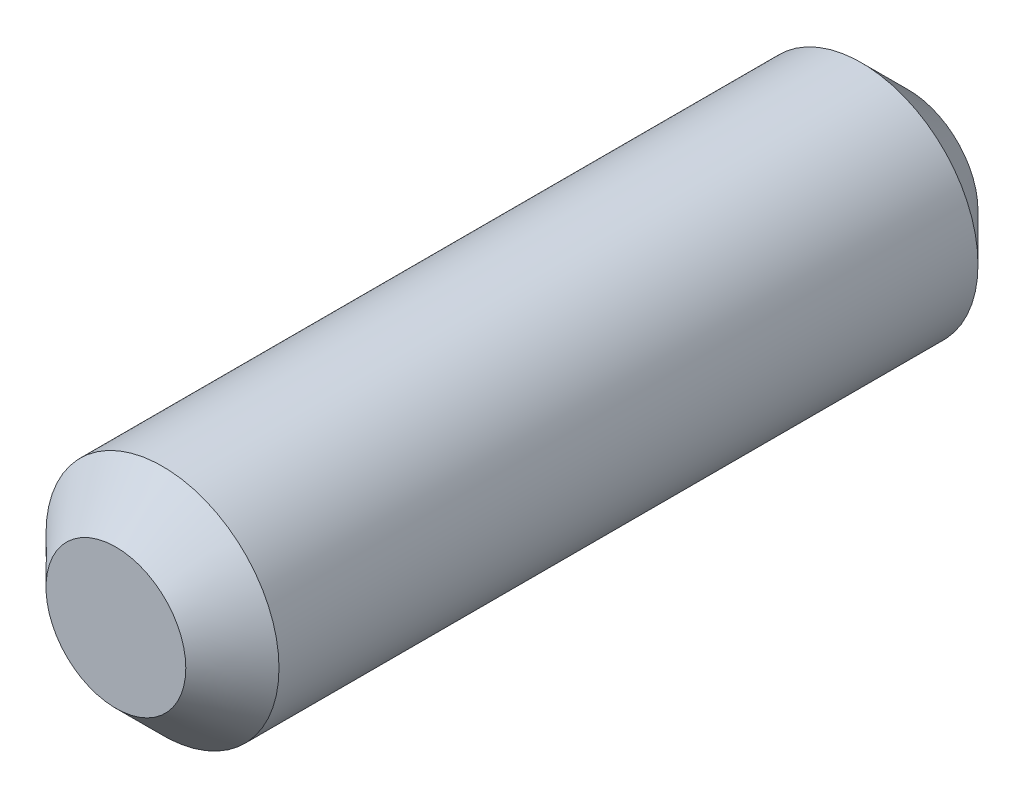
from build123d import *

# Parameters (mm, degrees)
SKETCH1_R           = 2.5
BOSS_EXTRUDE1_DEPTH = 8.5
CHAMFER1_SIZE       = 1


with BuildPart() as part:
    # Sketch1 → Boss-Extrude1 (new, symmetric)
    with BuildSketch(Plane.XY):
        Circle(SKETCH1_R)
    extrude(amount=BOSS_EXTRUDE1_DEPTH, both=True)

    # Chamfer1
    chamfer1_edges = [part.edges().sort_by_distance(p)[0] for p in [
        (-2.5, 0, -8.5),
        (-2.5, 0, 8.5),
    ]]
    chamfer(chamfer1_edges, length=CHAMFER1_SIZE)


solid = part.part
